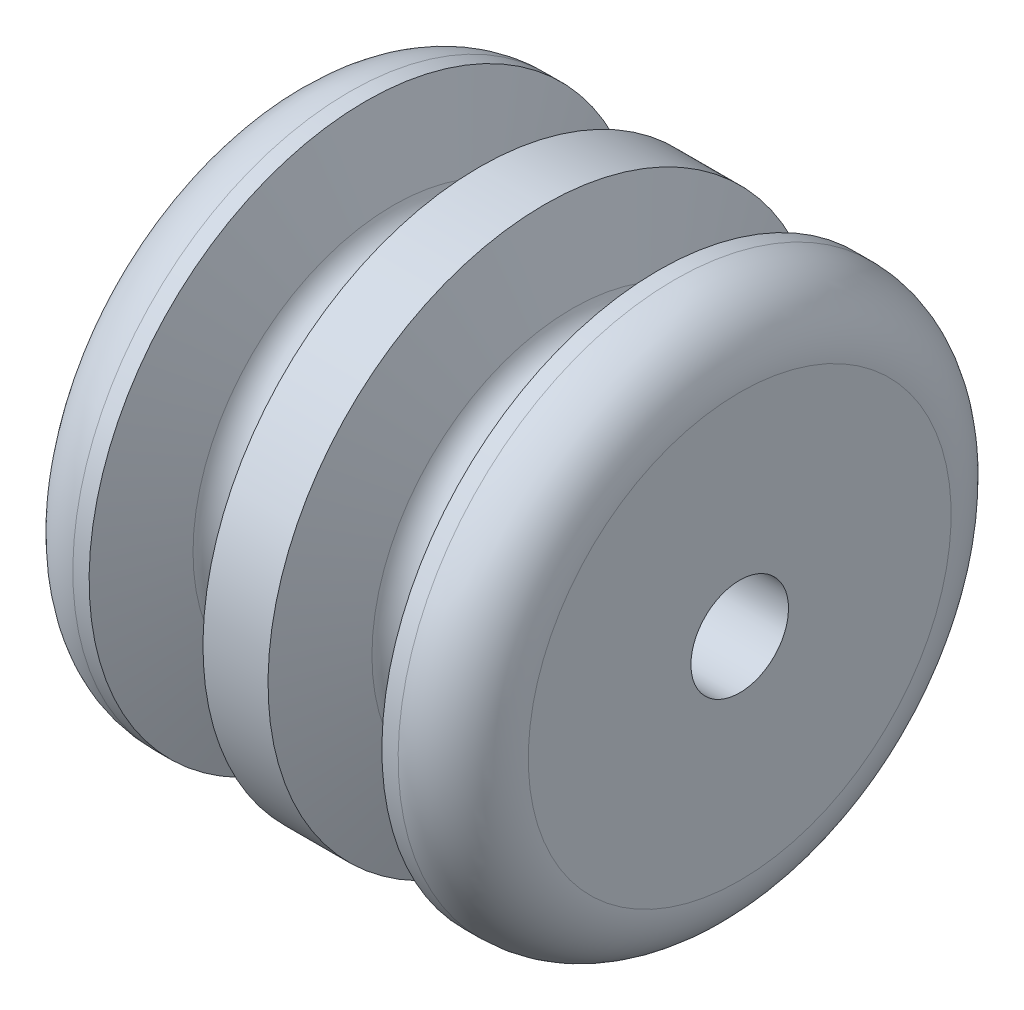
from build123d import *

# Parameters (mm, degrees)
SKETCH5_R          = 7.62
CUT_EXTRUDE2_DEPTH = 94.739421895


with BuildPart() as part:
    # Sketch1 → Revolve1 (revolve)
    with BuildSketch(Plane.XY):
        with BuildLine():
            Line((35.56, 0), (-35.56, 0))
            Line((-35.56, 0), (-35.56, 33.02))
            ThreePointArc((-35.56, 33.02), (-32.584204897, 40.204204897), (-25.4, 43.18))
            Line((-25.4, 43.18), (-22.86, 43.18))
            Line((-22.86, 43.18), (-18.529677849, 31.282537672))
            ThreePointArc((-18.529677849, 31.282537672), (-13.97, 28.08981687), (-9.410322151, 31.282537672))
            Line((-9.410322151, 31.282537672), (-5.08, 43.18))
            Line((-5.08, 43.18), (5.08, 43.18))
            Line((5.08, 43.18), (9.410322151, 31.282537672))
            ThreePointArc((9.410322151, 31.282537672), (13.97, 28.08981687), (18.529677849, 31.282537672))
            Line((18.529677849, 31.282537672), (22.86, 43.18))
            Line((22.86, 43.18), (25.4, 43.18))
            ThreePointArc((25.4, 43.18), (32.584204897, 40.204204897), (35.56, 33.02))
            Line((35.56, 33.02), (35.56, 0))
        make_face()
    revolve(axis=Axis((35.56, 0, 0), (-1, 0, 0)))

    # Sketch5 → Cut-Extrude2 (cut, through all)
    with BuildSketch(Plane(origin=(35.56, 0, 0), x_dir=(0, 0, -1), z_dir=(1, 0, 0))):
        with Locations(Location((0, 0, 0), (0, 0, 90))):
            Circle(SKETCH5_R)
    extrude(amount=-CUT_EXTRUDE2_DEPTH, mode=Mode.SUBTRACT)


solid = part.part
